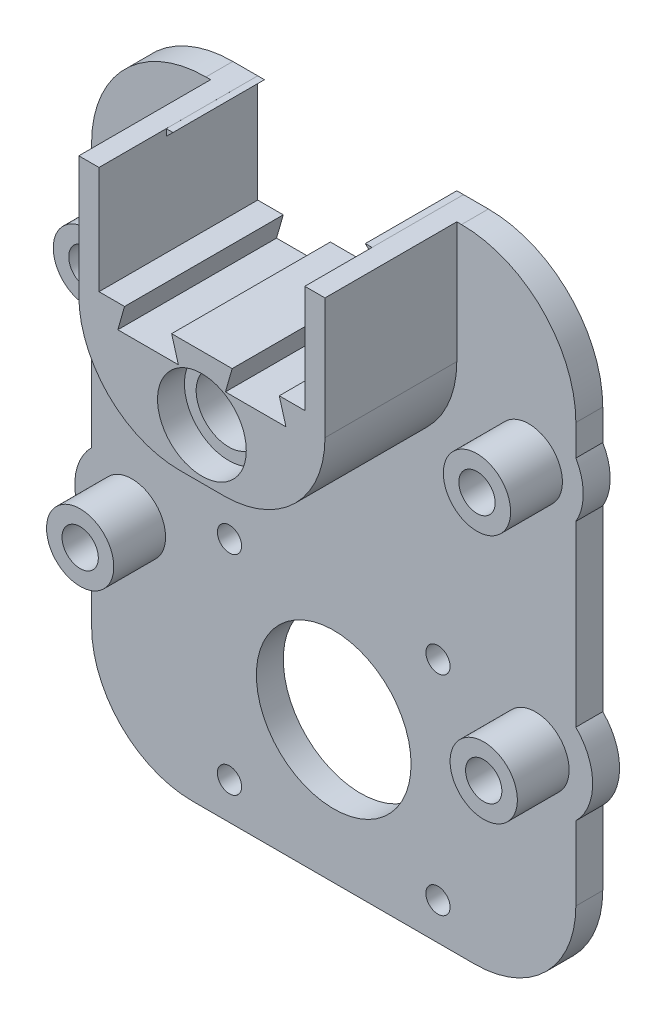
from build123d import *

# Parameters (mm, degrees)
SKETCH_1_R           = 2.8
SKETCH_1_R_2         = 2.7
SKETCH_1_R_3         = 1.8
SKETCH_1_R_4         = 11.5
EXTRUDE_1_DEPTH      = 4
EXTRUDE_START        = 4
SKETCH_1_4_R         = 2.8
EXTRUDE_3_DEPTH      = 19.6
SKETCH_9_R           = 5
SKETCH_9_R_2         = 2.7
EXTRUDE_4_DEPTH      = 7.7
FILLET_1_R           = 15
SKETCH_12_R          = 6.6
CUT_EXTRUDE_12_DEPTH = 4
CUT_EXTRUDE_START    = -8.8
SKETCH_12_5_R        = 4.849742261
SKETCH_12_5_R_2      = 2.8
CUT_EXTRUDE_13_DEPTH = 4.8
CUT_EXTRUDE_14_REACH = 72.202
CUT_EXTRUDE_15_DEPTH = 10


with BuildPart() as part:
    # 草图1 → 凸台-拉伸1 (new body)
    with BuildSketch(Plane.XY):
        with BuildLine():
            Line((-11.5, 37.75), (-15.3, 37.75))
            Line((-15.3, 37.75), (-15.3, 52.749))
            Line((-15.3, 52.749), (-14.3, 53.749))
            Line((-14.3, 53.749), (-15.3, 53.749))
            Line((-15.3, 53.749), (-15.3, 53.75))
            Line((-15.3, 53.75), (-19, 53.75))
            ThreePointArc((-19, 53.75), (-31.02081528, 48.77081528), (-36, 36.75))
            Line((-36, 36.75), (-36, 32.175536774))
            ThreePointArc((-36, 32.175536774), (-37.1, 28.1), (-36, 24.024463226))
            Line((-36, 24.024463226), (-36, -2.479202711))
            ThreePointArc((-36, -2.479202711), (-38.5, -8.5), (-36, -14.520797289))
            Line((-36, -14.520797289), (-36, -25.5))
            ThreePointArc((-36, -25.5), (-31.606601718, -36.106601718), (-21, -40.5))
            Line((-21, -40.5), (21, -40.5))
            ThreePointArc((21, -40.5), (31.606601718, -36.106601718), (36, -25.5))
            Line((36, -25.5), (36, -14.520797289))
            ThreePointArc((36, -14.520797289), (38.5, -8.5), (36, -2.479202711))
            Line((36, -2.479202711), (36, 24.024463226))
            ThreePointArc((36, 24.024463226), (37.1, 28.1), (36, 32.175536774))
            Line((36, 32.175536774), (36, 36.75))
            ThreePointArc((36, 36.75), (31.02081528, 48.77081528), (19, 53.75))
            Line((19, 53.75), (15.3, 53.75))
            Line((15.3, 53.75), (15.3, 53.749))
            Line((15.3, 53.749), (14.3, 53.749))
            Line((14.3, 53.749), (15.3, 52.749))
            Line((15.3, 52.749), (15.3, 37.75))
            Line((15.3, 37.75), (11.5, 37.75))
            Line((11.5, 37.75), (11.5, 34.25))
            Line((11.5, 34.25), (4.5, 34.25))
            Line((4.5, 34.25), (4.5, 37.75))
            Line((4.5, 37.75), (-4.5, 37.75))
            Line((-4.5, 37.75), (-4.5, 34.25))
            Line((-4.5, 34.25), (-11.5, 34.25))
            Line((-11.5, 34.25), (-11.5, 37.75))
        make_face()
        with Locations((0, 28.25)):
            Circle(SKETCH_1_R, mode=Mode.SUBTRACT)
        with Locations((-29, 28.1)):
            Circle(SKETCH_1_R_2, mode=Mode.SUBTRACT)
        with Locations((-30, -8.5)):
            Circle(SKETCH_1_R_2, mode=Mode.SUBTRACT)
        with Locations((29, 28.1)):
            Circle(SKETCH_1_R_2, mode=Mode.SUBTRACT)
        with Locations((30, -8.5)):
            Circle(SKETCH_1_R_2, mode=Mode.SUBTRACT)
        with Locations((15.5, -4)):
            Circle(SKETCH_1_R_3, mode=Mode.SUBTRACT)
        with Locations((0, -19.5)):
            Circle(SKETCH_1_R_4, mode=Mode.SUBTRACT)
        with Locations((15.5, -35)):
            Circle(SKETCH_1_R_3, mode=Mode.SUBTRACT)
        with Locations((-15.5, -35)):
            Circle(SKETCH_1_R_3, mode=Mode.SUBTRACT)
        with Locations((-15.5, -4)):
            Circle(SKETCH_1_R_3, mode=Mode.SUBTRACT)
    extrude(amount=EXTRUDE_1_DEPTH)

    # 草图1<4> → 凸台-拉伸3 (add)
    with BuildSketch(Plane.XY.offset(EXTRUDE_START)):
        Polygon((-11.5, 37.75), (-15.3, 37.75), (-15.3, 52.749), (-14.3, 53.749), (-15.3, 53.749), (-15.3, 53.75), (-18.3, 53.75), (-18.3, 20.75), (18.3, 20.75), (18.3, 53.75), (15.3, 53.75), (15.3, 53.749), (14.3, 53.749), (15.3, 52.749), (15.3, 37.75), (11.5, 37.75), (11.5, 34.25), (4.5, 34.25), (4.5, 37.75), (-4.5, 37.75), (-4.5, 34.25), (-11.5, 34.25), align=None)
        with Locations((0, 28.25)):
            Circle(SKETCH_1_4_R, mode=Mode.SUBTRACT)
    extrude(amount=EXTRUDE_3_DEPTH)

    # 草图9 → 凸台-拉伸4 (add)
    # profile 1 of 4: a face of its own
    with BuildSketch(Plane.XY.offset(4)):
        with Locations(Location((-29, 28.1, 0), (0, 0, 180))):
            Circle(SKETCH_9_R)
        with Locations((-29, 28.1)):
            Circle(SKETCH_9_R_2, mode=Mode.SUBTRACT)
    # profile 2 of 4: a face of its own
    with BuildSketch(Plane.XY.offset(4)):
        with Locations(Location((-30, -8.5, 0), (0, 0, 180))):
            Circle(SKETCH_9_R)
        with Locations((-30, -8.5)):
            Circle(SKETCH_9_R_2, mode=Mode.SUBTRACT)
    # profile 3 of 4: a face of its own
    with BuildSketch(Plane.XY.offset(4)):
        with Locations(Location((30, -8.5, 0), (0, 0, 180))):
            Circle(SKETCH_9_R)
        with Locations(Location((30, -8.5, 0), (0, 0, 180))):
            Circle(SKETCH_9_R_2, mode=Mode.SUBTRACT)
    # profile 4 of 4: a face of its own
    with BuildSketch(Plane.XY.offset(4)):
        with Locations(Location((29, 28.1, 0), (0, 0, 180))):
            Circle(SKETCH_9_R)
        with Locations(Location((29, 28.1, 0), (0, 0, 180))):
            Circle(SKETCH_9_R_2, mode=Mode.SUBTRACT)
    extrude(amount=EXTRUDE_4_DEPTH)

    # 圆角1
    fillet_1_edges = [part.edges().sort_by_distance(p)[0] for p in [
        (-18.3, 20.75, 13.8),
        (18.3, 20.75, 13.8),
    ]]
    fillet(fillet_1_edges, radius=FILLET_1_R)

    # 草图12 → 切除-拉伸12 (cut)
    with BuildSketch(Plane.XY.offset(23.6)):
        with Locations((0, 28.25)):
            Circle(SKETCH_12_R)
    extrude(amount=-CUT_EXTRUDE_12_DEPTH, mode=Mode.SUBTRACT)

    # 草图12<5> → 切除-拉伸13 (cut)
    with BuildSketch(Plane.XY.offset(23.6).offset(CUT_EXTRUDE_START)):
        with Locations((0, 28.25)):
            Circle(SKETCH_12_5_R)
        with Locations((0, 28.25)):
            Circle(SKETCH_12_5_R_2, mode=Mode.SUBTRACT)
    extrude(amount=CUT_EXTRUDE_13_DEPTH, mode=Mode.SUBTRACT)

    # 草图13 → 切除-拉伸14 (cut, up to next)
    with BuildSketch(Plane.XY.offset(23.6), mode=Mode.PRIVATE) as cut_extrude_14_sk1:
        Polygon((-4.5, 37.75), (-3.5, 34.25), (-4.5, 34.25), align=None)
    cut_extrude_14_tool1 = extrude(cut_extrude_14_sk1.sketch, amount=-CUT_EXTRUDE_14_REACH, mode=Mode.PRIVATE) & part.part
    # 草图13 → 切除-拉伸14 (cut, up to next)
    with BuildSketch(Plane.XY.offset(23.6), mode=Mode.PRIVATE) as cut_extrude_14_sk2:
        Polygon((-11.5, 34.25), (-11.5, 37.75), (-12.5, 34.25), align=None)
    cut_extrude_14_tool2 = extrude(cut_extrude_14_sk2.sketch, amount=-CUT_EXTRUDE_14_REACH, mode=Mode.PRIVATE) & part.part
    # 草图13 → 切除-拉伸14 (cut, up to next)
    with BuildSketch(Plane.XY.offset(23.6), mode=Mode.PRIVATE) as cut_extrude_14_sk3:
        Polygon((11.5, 37.75), (12.5, 34.25), (11.5, 34.25), align=None)
    cut_extrude_14_tool3 = extrude(cut_extrude_14_sk3.sketch, amount=-CUT_EXTRUDE_14_REACH, mode=Mode.PRIVATE) & part.part
    # 草图13 → 切除-拉伸14 (cut, up to next)
    with BuildSketch(Plane.XY.offset(23.6), mode=Mode.PRIVATE) as cut_extrude_14_sk4:
        Polygon((4.5, 34.25), (4.5, 37.75), (3.5, 34.25), align=None)
    cut_extrude_14_tool4 = extrude(cut_extrude_14_sk4.sketch, amount=-CUT_EXTRUDE_14_REACH, mode=Mode.PRIVATE) & part.part
    add(cut_extrude_14_tool1.solids().sort_by_distance((-4.166667, 35.416667, 23.6))[0], mode=Mode.SUBTRACT)
    add(cut_extrude_14_tool2.solids().sort_by_distance((-11.833333, 35.416667, 23.6))[0], mode=Mode.SUBTRACT)
    add(cut_extrude_14_tool3.solids().sort_by_distance((11.833333, 35.416667, 23.6))[0], mode=Mode.SUBTRACT)
    add(cut_extrude_14_tool4.solids().sort_by_distance((4.166667, 35.416667, 23.6))[0], mode=Mode.SUBTRACT)

    # 草图14 → 切除-拉伸15 (cut)
    with BuildSketch(Plane.XY.offset(23.6)):
        Polygon((-15.3, 53.749), (-15.3, 52.749), (-14.3, 53.749), align=None)
        Polygon((14.3, 53.749), (15.3, 52.749), (15.3, 53.749), align=None)
    extrude(amount=-CUT_EXTRUDE_15_DEPTH, mode=Mode.SUBTRACT)


solid = part.part
